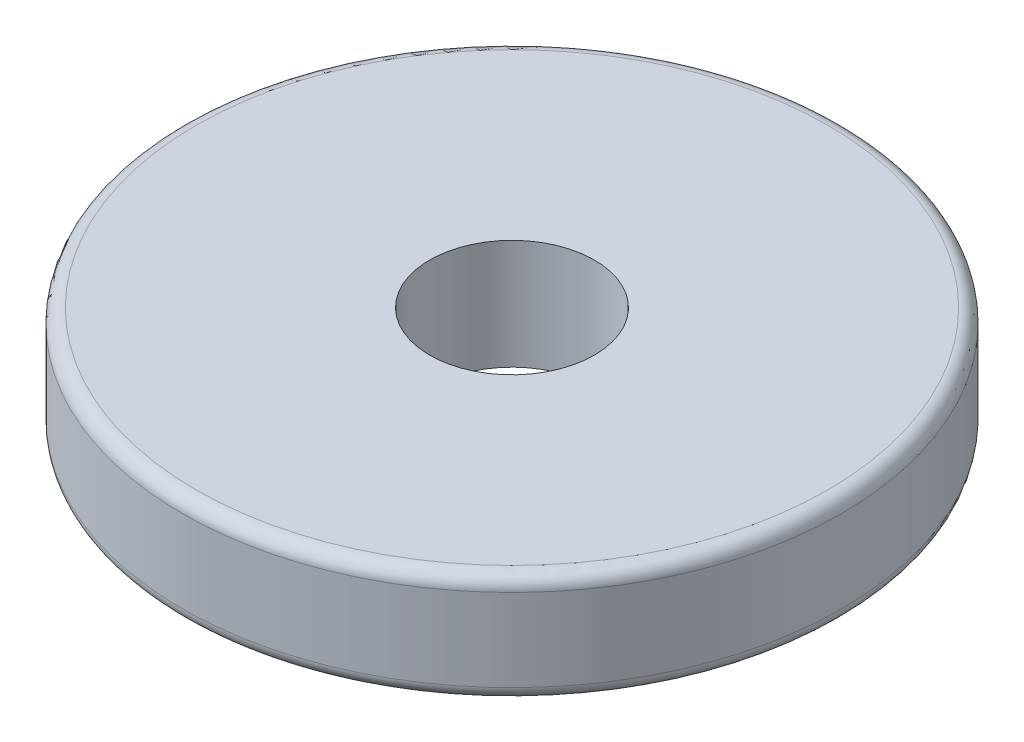
from build123d import *

# Parameters (mm, degrees)
SKETCH_1_W = 19.5
SKETCH_1_H = 7


with BuildPart() as part:
    # 草图1 → 旋转3 (revolve)
    with BuildSketch(Plane.XY):
        with BuildLine():
            Line((7.5, 5), (7.5, -5))
            Line((7.5, -5), (28.75, -5))
            ThreePointArc((28.75, -5), (29.633883476, -4.633883476), (30, -3.75))
            Line((30, -3.75), (30, 3.75))
            ThreePointArc((30, 3.75), (29.633883476, 4.633883476), (28.75, 5))
            Line((28.75, 5), (7.5, 5))
        make_face()
        with Locations((18.75, 0)):
            Rectangle(SKETCH_1_W, SKETCH_1_H, mode=Mode.SUBTRACT)
    revolve(axis=Axis((0, -346.416551839, 0), (0, 1, 0)))


solid = part.part
